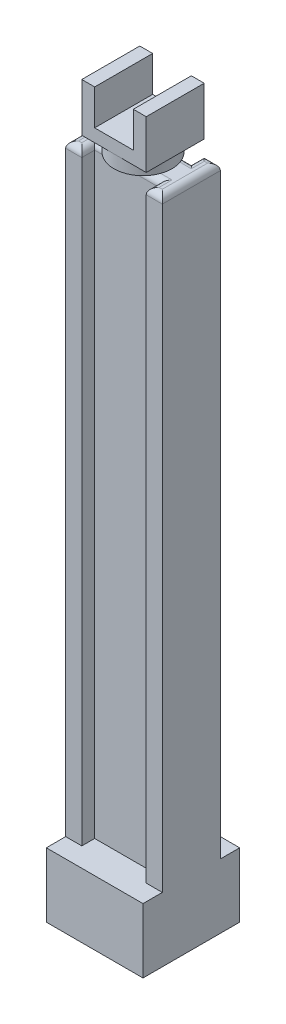
from build123d import *

# Parameters (mm, degrees)
SKETCH2_W           = 150
SKETCH2_H           = 150
BOSS_EXTRUDE1_DEPTH = 1035
SKETCH3_W           = 100
SKETCH3_H           = 50
CUT_EXTRUDE3_DEPTH  = 935
SKETCH4_W           = 150
SKETCH4_H           = 30
CUT_EXTRUDE4_DEPTH  = 935
FILLET1_R           = 10
SKETCH5_R           = 45
BOSS_EXTRUDE2_DEPTH = 20
BOSS_EXTRUDE3_START = -45
SKETCH6_W           = 100
SKETCH6_H           = 75
BOSS_EXTRUDE3_DEPTH = 90
SKETCH7_W           = 60
SKETCH7_H           = 110
CUT_EXTRUDE5_DEPTH  = 90


with BuildPart() as part:
    # Sketch2 → Boss-Extrude1 (new body)
    with BuildSketch(Plane(origin=(0, 0, 0), x_dir=(1, 0, 0), z_dir=(0, 1, 0))):
        Rectangle(SKETCH2_W, SKETCH2_H)
    extrude(amount=BOSS_EXTRUDE1_DEPTH)

    # Sketch3 → Cut-Extrude3 (cut)
    with BuildSketch(Plane(origin=(0, 1035, 0), x_dir=(-1, 0, 0), z_dir=(0, 1, 0))):
        with Locations((0, -50)):
            Rectangle(SKETCH3_W, SKETCH3_H)
        with Locations((0, 50)):
            Rectangle(SKETCH3_W, SKETCH3_H)
    extrude(amount=-CUT_EXTRUDE3_DEPTH, mode=Mode.SUBTRACT)

    # Sketch4 → Cut-Extrude4 (cut)
    with BuildSketch(Plane(origin=(0, 1035, 0), x_dir=(-1, 0, 0), z_dir=(0, 1, 0))):
        with Locations((0, -60)):
            Rectangle(SKETCH4_W, SKETCH4_H)
        with Locations((0, 60)):
            Rectangle(SKETCH4_W, SKETCH4_H)
    extrude(amount=-CUT_EXTRUDE4_DEPTH, mode=Mode.SUBTRACT)

    # Fillet1
    fillet1_edges = [part.edges().sort_by_distance(p)[0] for p in [
        (0, 1035, -25),
        (50, 1035, -35),
        (0, 1035, 25),
        (-50, 1035, 35),
        (-50, 1035, -35),
        (-75, 1035, 0),
        (-62.5, 1035, -45),
        (62.5, 1035, -45),
        (50, 1035, 35),
        (75, 1035, 0),
        (62.5, 1035, 45),
        (-62.5, 1035, 45),
    ]]
    fillet(fillet1_edges, radius=FILLET1_R)

    # Sketch5 → Boss-Extrude2 (add)
    with BuildSketch(Plane(origin=(0, 1035, 0), x_dir=(-1, 0, 0), z_dir=(0, 1, 0))):
        with Locations(Location((0, 0, 0), (0, 0, 199.471220634))):
            Circle(SKETCH5_R)
    extrude(amount=BOSS_EXTRUDE2_DEPTH)

    # Sketch6 → Boss-Extrude3 (add)
    with BuildSketch(Plane.XY.offset(BOSS_EXTRUDE3_START)):
        with Locations((0, 1092.5)):
            Rectangle(SKETCH6_W, SKETCH6_H)
    extrude(amount=BOSS_EXTRUDE3_DEPTH)

    # Sketch7 → Cut-Extrude5 (cut)
    with BuildSketch(Plane.XY.offset(45)):
        with Locations((0, 1130)):
            Rectangle(SKETCH7_W, SKETCH7_H)
    extrude(amount=-CUT_EXTRUDE5_DEPTH, mode=Mode.SUBTRACT)


solid = part.part
